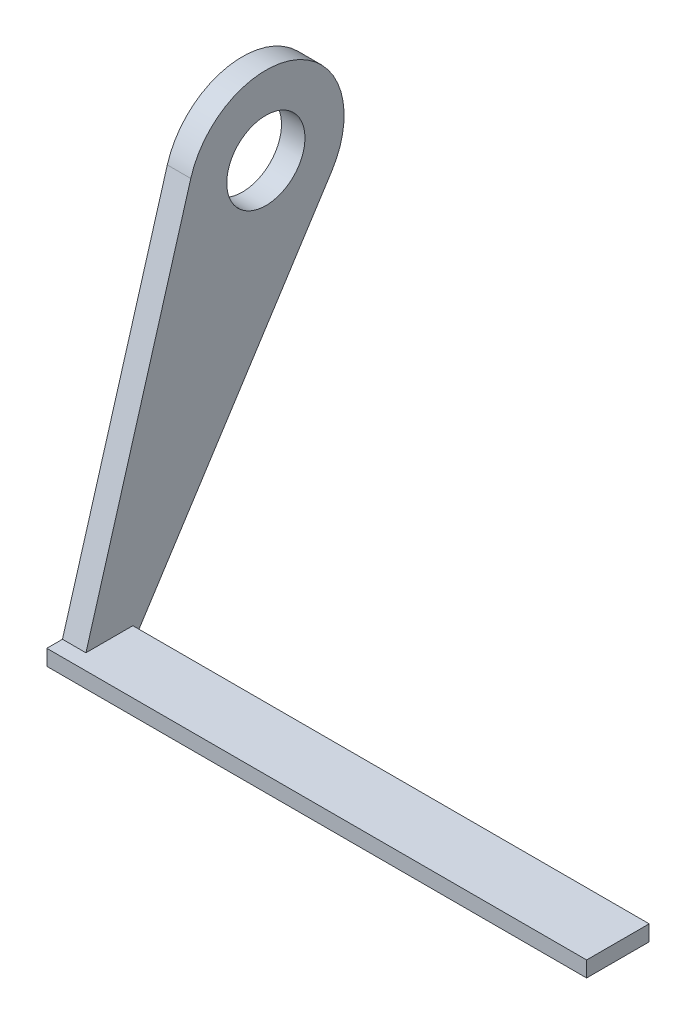
from build123d import *

# Parameters (mm, degrees)
BOSS_EXTRUDE1_DEPTH = 17.526
SKETCH1_3_R         = 1.27
BOSS_EXTRUDE2_DEPTH = 0.762


with BuildPart() as part:
    # Sketch1 → Boss-Extrude1 (new body)
    with BuildSketch(Plane(origin=(0, 0, 0), x_dir=(0, 0, -1), z_dir=(1, 0, 0))):
        Polygon((-6.35, -11.43), (-4.318, -11.43), (-4.318, -10.922), (-5.842, -10.922), (-6.35, -10.922), align=None)
    extrude(amount=BOSS_EXTRUDE1_DEPTH)

    # Sketch1<3> → Boss-Extrude2 (add)
    with BuildSketch(Plane(origin=(0, 0, 0), x_dir=(0, 0, -1), z_dir=(1, 0, 0))):
        with BuildLine():
            Line((-4.318, -11.43), (2.137587014, -1.371977316))
            ThreePointArc((2.137587014, -1.371977316), (1.053360752, 2.311283437), (-2.437803052, 0.713243493))
            Line((-2.437803052, 0.713243493), (-5.842, -10.922))
            Line((-5.842, -10.922), (-4.318, -10.922))
            Line((-4.318, -10.922), (-4.318, -11.43))
        make_face()
        Circle(SKETCH1_3_R, mode=Mode.SUBTRACT)
    extrude(amount=BOSS_EXTRUDE2_DEPTH)


solid = part.part
